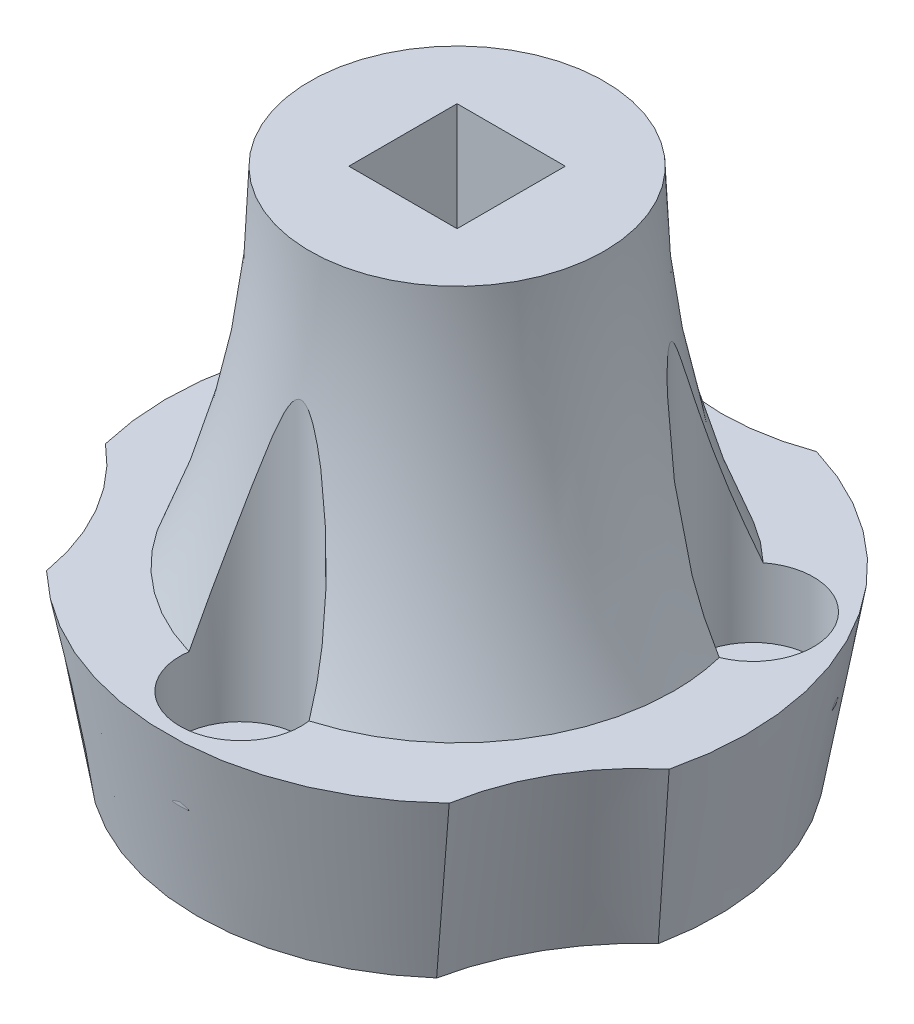
from build123d import *

# Parameters (mm, degrees)
BOSS_EXTRUDE1_DEPTH     = 5.08
BOSS_EXTRUDE1_DRAFT     = -10
SKETCH2_R               = 1.016
CUT_EXTRUDE1_DEPTH      = 14.07065766
SKETCH3_R               = 1.778
CUT_EXTRUDE2_DEPTH      = 2.032
SKETCH4_R               = 4.3815
CUT_EXTRUDE3_DEPTH      = 2.032
CUT_EXTRUDE4_DEPTH      = 10.16
CUT_EXTRUDE4_DEPTH_BACK = 2.032
SKETCH3_2_R             = 1.778
SKETCH7_W               = 3.175
SKETCH7_H               = 3.175
CUT_EXTRUDE5_DEPTH      = 11.43


with BuildPart() as part:
    # Sketch1 → Boss-Extrude1 (with draft: the straight prism first)
    with BuildSketch(Plane(origin=(0, 0, 0), x_dir=(1, 0, 0), z_dir=(0, 1, 0))):
        with BuildLine():
            ThreePointArc((7.458830017, -1.558927446), (6.599113577, 3.81), (2.379344237, 7.239))
            ThreePointArc((2.379344237, 7.239), (0, 6.858), (-2.379344237, 7.239))
            ThreePointArc((-2.379344237, 7.239), (-6.599113577, 3.81), (-7.458830017, -1.558927446))
            ThreePointArc((-7.458830017, -1.558927446), (-5.939202219, -3.429), (-5.079485779, -5.680072554))
            ThreePointArc((-5.079485779, -5.680072554), (0, -7.62), (5.079485779, -5.680072554))
            ThreePointArc((5.079485779, -5.680072554), (5.939202219, -3.429), (7.458830017, -1.558927446))
        make_face()
    extrude(amount=BOSS_EXTRUDE1_DEPTH)
    # Boss-Extrude1: the draft: its side faces are tilted about the plane it starts from
    boss_extrude1_sides = [part.faces().sort_by_distance(p)[0] for p in [
        (5.939202219, 2.54, 3.429),
        (6.599113577, 2.54, -3.81),
        (0, 2.54, -6.858),
        (-6.599113577, 2.54, -3.81),
        (-5.939202219, 2.54, 3.429),
        (0, 2.54, 7.62),
    ]]
    draft(boss_extrude1_sides, Plane(origin=(0, 0, 0), x_dir=(1, 0, 0), z_dir=(0, 1, 0)), BOSS_EXTRUDE1_DRAFT)

    # Sketch2 → Cut-Extrude1 (cut, through all)
    with BuildSketch(Plane(origin=(0, 5.08, 0), x_dir=(1, 0, 0), z_dir=(0, 1, 0))):
        with Locations((0, -6.35)):
            Circle(SKETCH2_R)
        with Locations((-5.499261314, 3.175)):
            Circle(SKETCH2_R)
        with Locations((5.499261314, 3.175)):
            Circle(SKETCH2_R)
    extrude(amount=-CUT_EXTRUDE1_DEPTH, mode=Mode.SUBTRACT)

    # Sketch3 → Cut-Extrude2 (cut)
    with BuildSketch(Plane(origin=(0, 5.08, 0), x_dir=(1, 0, 0), z_dir=(0, 1, 0))):
        with Locations((0, -6.35)):
            Circle(SKETCH3_R)
        with Locations((-5.499261314, 3.175)):
            Circle(SKETCH3_R)
        with Locations((5.499261314, 3.175)):
            Circle(SKETCH3_R)
    extrude(amount=-CUT_EXTRUDE2_DEPTH, mode=Mode.SUBTRACT)

    # Sketch4 → Cut-Extrude3 (cut)
    with BuildSketch(Plane.XZ):
        Circle(SKETCH4_R)
    extrude(amount=-CUT_EXTRUDE3_DEPTH, mode=Mode.SUBTRACT)

    # Sketch6 → Revolve1 (revolve)
    with BuildSketch(Plane.XY):
        with BuildLine():
            Line((0, 5.08), (0, 15.24))
            Line((0, 15.24), (4.318, 15.24))
            ThreePointArc((4.318, 15.24), (4.830980871, 10.059396174), (6.35, 5.08))
            Line((6.35, 5.08), (0, 5.08))
        make_face()
    revolve(axis=Axis((0, 5.08, 0), (0, 1, 0)))

    # Sketch3<2> → Cut-Extrude4 (cut, two sides: drawn at the far end of the back side and taken through both)
    with BuildSketch(Plane(origin=(0, 5.08, 0), x_dir=(1, 0, 0), z_dir=(0, 1, 0)).offset(-CUT_EXTRUDE4_DEPTH_BACK)):
        with Locations((0, -6.35)):
            Circle(SKETCH3_2_R)
        with Locations((-5.499261314, 3.175)):
            Circle(SKETCH3_2_R)
        with Locations((5.499261314, 3.175)):
            Circle(SKETCH3_2_R)
    extrude(amount=CUT_EXTRUDE4_DEPTH + CUT_EXTRUDE4_DEPTH_BACK, mode=Mode.SUBTRACT)

    # Sketch7 → Cut-Extrude5 (cut)
    with BuildSketch(Plane(origin=(0, 15.24, 0), x_dir=(1, 0, 0), z_dir=(0, 1, 0))):
        Rectangle(SKETCH7_W, SKETCH7_H)
    extrude(amount=-CUT_EXTRUDE5_DEPTH, mode=Mode.SUBTRACT)


solid = part.part
